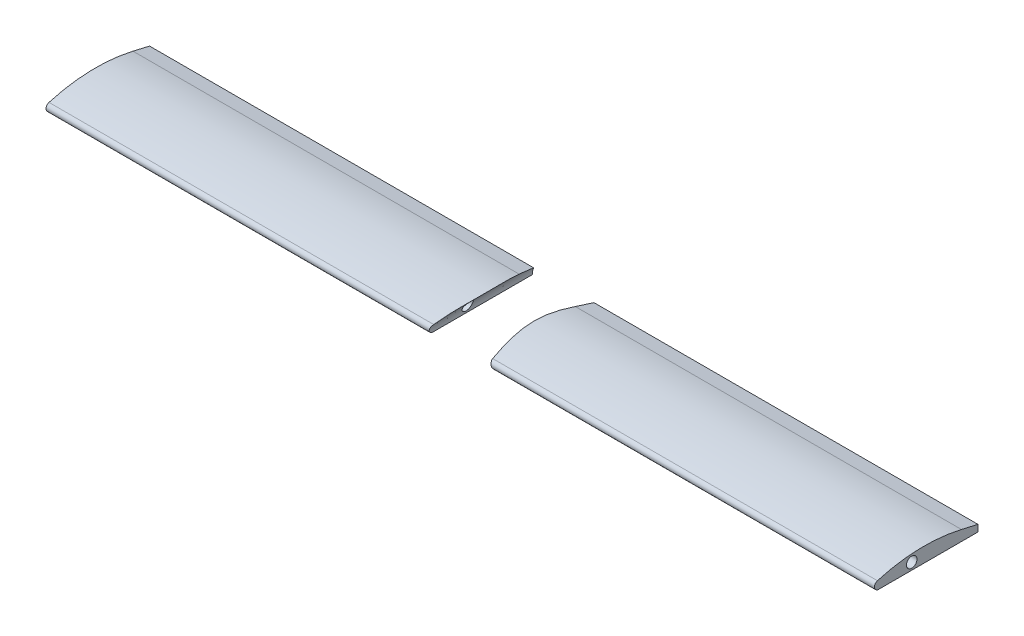
from build123d import *

# Parameters (mm, degrees)
SKETCH1_R               = 6.35
BOSS_EXTRUDE1_DEPTH     = 500
CUT_EXTRUDE1_DEPTH      = 515.507726342
CUT_EXTRUDE1_DEPTH_BACK = 515.507726342
SKETCH2_RX              = 38
SKETCH2_RY              = 28


with BuildPart() as part:
    # Sketch1 → Boss-Extrude1 (new, symmetric)
    with BuildSketch(Plane(origin=(0, 0, 0), x_dir=(0, 0, -1), z_dir=(1, 0, 0))):
        with BuildLine():
            Line((0, 0), (120, 0))
            Line((120, 0), (120, 8))
            Line((120, 8), (100, 12.647547086))
            ThreePointArc((100, 12.647547086), (49.114720166, 17.759310395), (-1.403352078, 9.799021169))
            ThreePointArc((-1.403352078, 9.799021169), (-4.94950068, 4.291164768), (0, 0))
        make_face()
        with Locations((40.05049932, 8.5)):
            Circle(SKETCH1_R, mode=Mode.SUBTRACT)
    extrude(amount=BOSS_EXTRUDE1_DEPTH, both=True)

    # Sketch2 → Cut-Extrude1 (cut, two sides: drawn at the far end of the back side and taken through both)
    with BuildSketch(Plane.XY.offset(-CUT_EXTRUDE1_DEPTH_BACK)):
        with Locations(Location((0, 0), (0, 0, -180))):
            Ellipse(SKETCH2_RX, SKETCH2_RY)
    extrude(amount=CUT_EXTRUDE1_DEPTH + CUT_EXTRUDE1_DEPTH_BACK, mode=Mode.SUBTRACT)


with BuildPart() as cut_extrude1_piece_1:
    # of the separate pieces the step leaves, piece 1, a body of its own (cut_extrude1_pieces)
    add(part.part.solids().sort_by_distance((-35.596984901, 9.799021169, 1.403352078))[0])


with BuildPart() as cut_extrude1_piece_2:
    # of the separate pieces the step leaves, piece 2, a body of its own (cut_extrude1_pieces)
    add(part.part.solids().sort_by_distance((500, 9.799021169, 1.403352078))[0])


solid = Compound([cut_extrude1_piece_1.part, cut_extrude1_piece_2.part])
